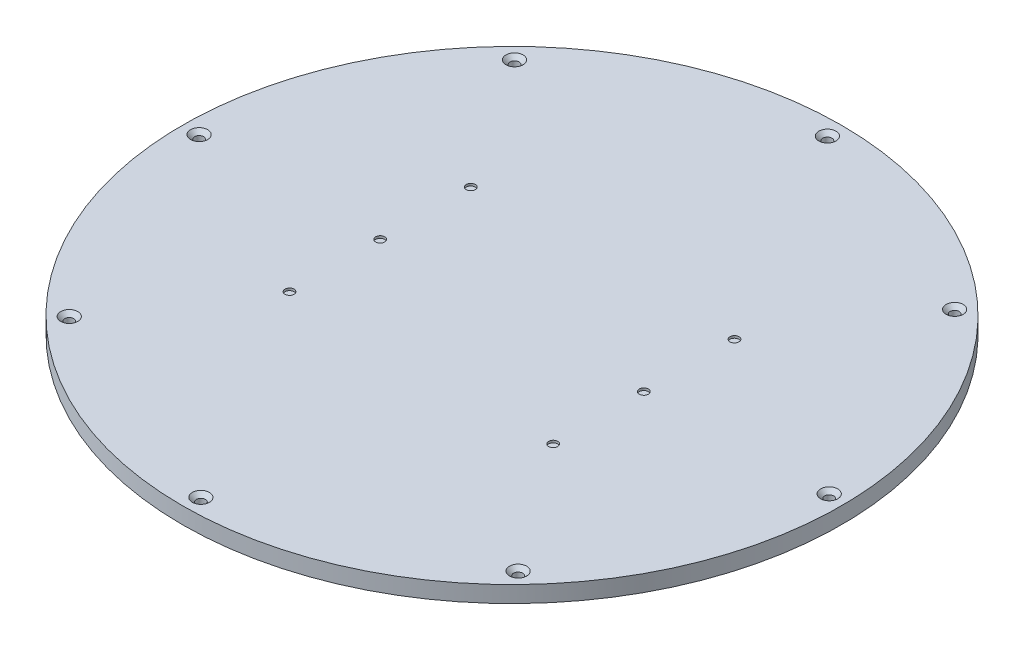
from build123d import *

# Parameters (mm, degrees)
SKETCH1_R                                       = 200
BOSS_EXTRUDE1_DEPTH                             = 10
CSK_FOR_M5_FLAT_HEAD_MACHINE_SCREW1_D           = 5.5
CSK_FOR_M5_FLAT_HEAD_MACHINE_SCREW1_CSINK_D     = 10.4
CSK_FOR_M5_FLAT_HEAD_MACHINE_SCREW1_CSINK_ANGLE = 90
SHELL1_T                                        = 1.4
CSK_FOR_M5_FLAT_HEAD_MACHINE_SCREW2_D           = 5.5
CSK_FOR_M5_FLAT_HEAD_MACHINE_SCREW2_CSINK_D     = 10.4
CSK_FOR_M5_FLAT_HEAD_MACHINE_SCREW2_CSINK_ANGLE = 90


with BuildPart() as part:
    # Sketch1 → Boss-Extrude1 (new body)
    with BuildSketch(Plane(origin=(0, 0, 0), x_dir=(1, 0, 0), z_dir=(0, 1, 0))):
        with Locations(Location((0, 0, 0), (0, 0, 270))):
            Circle(SKETCH1_R)
    extrude(amount=BOSS_EXTRUDE1_DEPTH)

    # CSK for M5 Flat Head Machine Screw1 (through all)
    with Locations(Plane(origin=(0, 10, 0), x_dir=(1, 0, 0), z_dir=(0, 1, 0))):
        with Locations((-189.999966012, 0.113646638), (1.41743193, 189.994712786), (189.983382613, 2.512833264), (1.187924025, -189.996286376), (-133.812075975, -134.886353362), (-133.58256807, 135.113646638), (131.111481907, 137.512833264), (136.187924025, -132.487166736)):
            CounterSinkHole(CSK_FOR_M5_FLAT_HEAD_MACHINE_SCREW1_D / 2, CSK_FOR_M5_FLAT_HEAD_MACHINE_SCREW1_CSINK_D / 2, counter_sink_angle=CSK_FOR_M5_FLAT_HEAD_MACHINE_SCREW1_CSINK_ANGLE)

    # Shell1 (no face opened: a closed hollow body)
    add(offset(amount=-SHELL1_T, mode=Mode.PRIVATE), mode=Mode.SUBTRACT)

    # CSK for M5 Flat Head Machine Screw2 (through all)
    with Locations(Plane(origin=(0, 0, 0), x_dir=(-1, 0, 0), z_dir=(0, -1, 0))):
        with Locations((-80, 0), (-80, 55), (-80, -55), (80, 0), (80, 55), (80, -55)):
            CounterSinkHole(CSK_FOR_M5_FLAT_HEAD_MACHINE_SCREW2_D / 2, CSK_FOR_M5_FLAT_HEAD_MACHINE_SCREW2_CSINK_D / 2, counter_sink_angle=CSK_FOR_M5_FLAT_HEAD_MACHINE_SCREW2_CSINK_ANGLE)


solid = part.part
